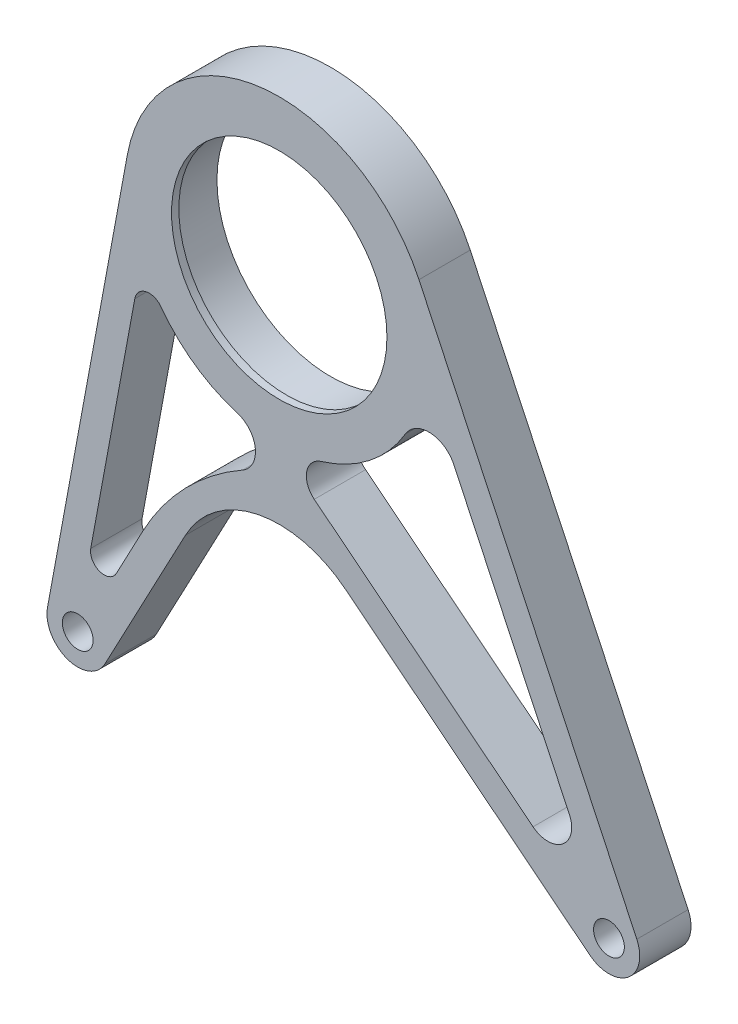
from build123d import *

# Parameters (mm, degrees)
BOSS_EXTRUDE1_DEPTH = 7
SKETCH3_R           = 4.2
SKETCH3_R_2         = 31
CUT_EXTRUDE1_DEPTH  = 156.951680739
SKETCH5_R           = 31
SKETCH5_R_2         = 29.4
BOSS_EXTRUDE3_DEPTH = 2
CUT_EXTRUDE3_DEPTH  = 156.951680739


with BuildPart() as part:
    # Sketch1 → Boss-Extrude1 (new, symmetric)
    with BuildSketch(Plane.XY):
        with BuildLine():
            Line((-41.457265734, 7.66555398), (-63.259986532, -110.249105832))
            ThreePointArc((-63.259986532, -110.249105832), (-57.764447863, -119.708474266), (-47.579981062, -115.713823794))
            Line((-47.579981062, -115.713823794), (-25.616732048, -74.324411645))
            ThreePointArc((-25.616732048, -74.324411645), (-5.909772036, -59.526451333), (18.065040544, -65.231910476))
            Line((18.065040544, -65.231910476), (84.767367566, -118.347513787))
            ThreePointArc((84.767367566, -118.347513787), (95.212080879, -118.36382677), (97.598433891, -108.195364664))
            Line((97.598433891, -108.195364664), (38.136901528, 17.973378699))
            ThreePointArc((38.136901528, 17.973378699), (-5.414703798, 41.810842885), (-41.457265734, 7.66555398))
        make_face()
    extrude(amount=BOSS_EXTRUDE1_DEPTH, both=True)

    # Sketch3 → Cut-Extrude1 (cut, through all)
    with BuildSketch(Plane.XY.offset(7)):
        with Locations((-55, -111.776398371)):
            Circle(SKETCH3_R)
        with Locations((90, -111.776398371)):
            Circle(SKETCH3_R)
        Circle(SKETCH3_R_2)
    extrude(amount=-CUT_EXTRUDE1_DEPTH, mode=Mode.SUBTRACT)

    # Sketch5 → Boss-Extrude3 (add)
    with BuildSketch(Plane.XY.offset(7)):
        Circle(SKETCH5_R)
        Circle(SKETCH5_R_2, mode=Mode.SUBTRACT)
    extrude(amount=-BOSS_EXTRUDE3_DEPTH)

    # Sketch7 → Cut-Extrude3 (cut, through all)
    with BuildSketch(Plane(origin=(0, 0, -7), x_dir=(-1, 0, 0), z_dir=(0, 0, -1))):
        with BuildLine():
            Line((39.416599892, -25.297435332), (51.444133318, -90.345395421))
            ThreePointArc((51.444133318, -90.345395421), (48.99824365, -94.555459787), (44.465461038, -92.777567771))
            Line((44.465461038, -92.777567771), (37.224653842, -79.132375609))
            ThreePointArc((37.224653842, -79.132375609), (25.615584401, -63.184563156), (10.018252925, -51.108700201))
            ThreePointArc((10.018252925, -51.108700201), (6.525820517, -44.233938334), (11.473159104, -38.319272177))
            ThreePointArc((11.473159104, -38.319272177), (23.05966211, -32.684124333), (32.253697166, -23.657958896))
            ThreePointArc((32.253697166, -23.657958896), (36.373945084, -22.123685051), (39.416599892, -25.297435332))
        make_face()
        with BuildLine():
            Line((-47.659866623, -20.998502649), (-79.20248655, -87.927365066))
            ThreePointArc((-79.20248655, -87.927365066), (-77.355903862, -95.795817886), (-69.273685228, -95.783194745))
            Line((-69.273685228, -95.783194745), (-9.558730446, -48.231692548))
            ThreePointArc((-9.558730446, -48.231692548), (-7.514321735, -42.69576591), (-11.473159104, -38.319272177))
            ThreePointArc((-11.473159104, -38.319272177), (-24.638900988, -31.510705453), (-34.421516336, -20.375456146))
            ThreePointArc((-34.421516336, -20.375456146), (-41.228138553, -16.704146639), (-47.659866623, -20.998502649))
        make_face()
    extrude(amount=-CUT_EXTRUDE3_DEPTH, mode=Mode.SUBTRACT)


solid = part.part
